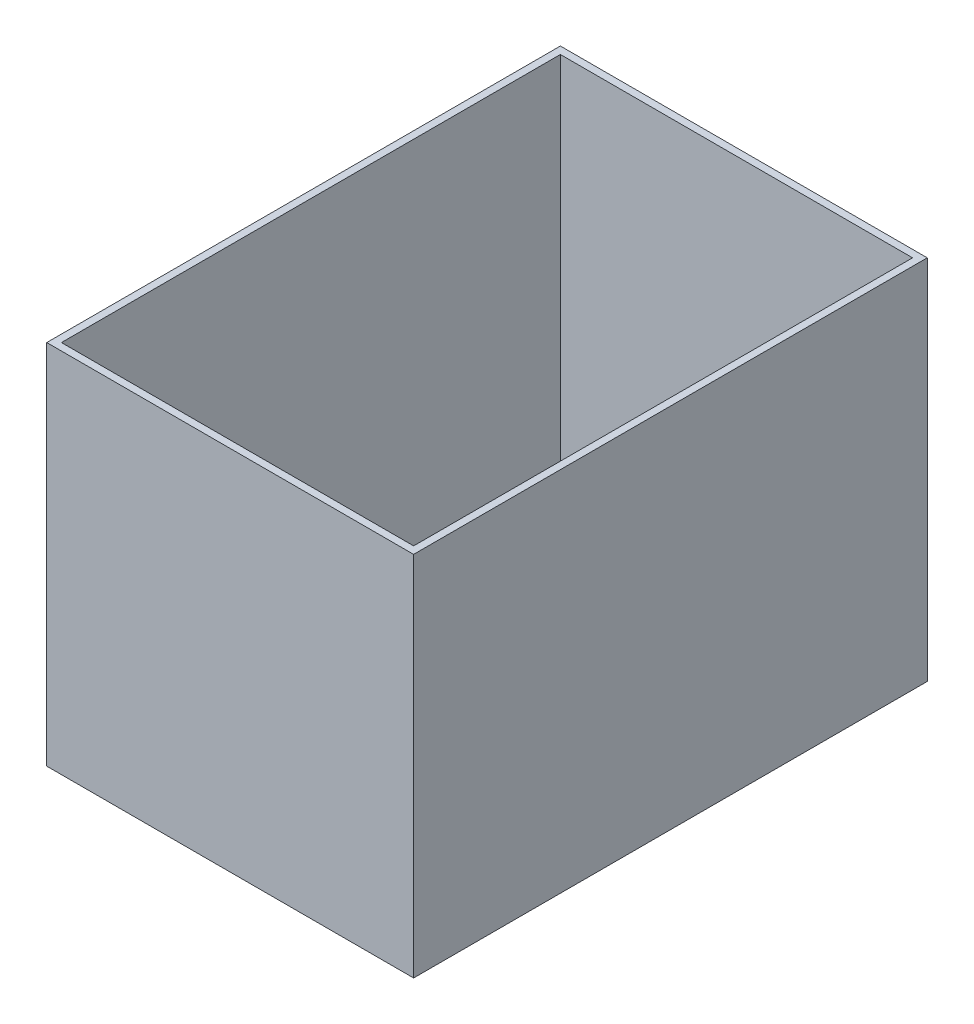
from build123d import *

# Parameters (mm, degrees)
SKETCH1_W           = 500
SKETCH1_H           = 700
BOSS_EXTRUDE1_DEPTH = 500
SHELL1_T            = -10


with BuildPart() as part:
    # Sketch1 → Boss-Extrude1 (new body)
    with BuildSketch(Plane(origin=(0, 0, 0), x_dir=(1, 0, 0), z_dir=(0, 1, 0))):
        Rectangle(SKETCH1_W, SKETCH1_H)
    extrude(amount=BOSS_EXTRUDE1_DEPTH)

    # Shell1
    shell1_openings = [part.faces().sort_by_distance(p)[0] for p in [
        (0, 500, 0),
    ]]
    offset(amount=SHELL1_T, openings=shell1_openings, kind=Kind.INTERSECTION)


solid = part.part
